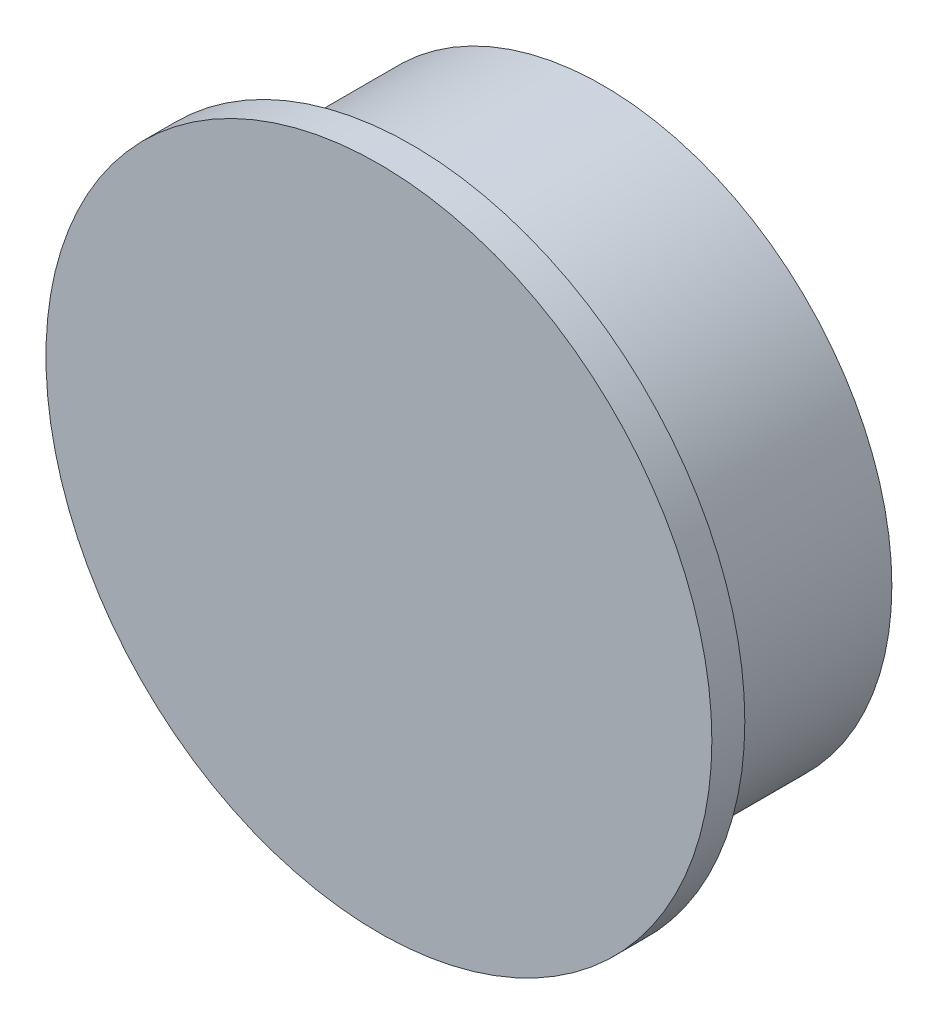
from build123d import *

# Parameters (mm, degrees)
SKETCH1_R           = 30.5
BOSS_EXTRUDE1_DEPTH = 20.18
SKETCH2_R           = 35.155
BOSS_EXTRUDE2_DEPTH = 3.48


with BuildPart() as part:
    # Sketch1 → Boss-Extrude1 (new body)
    with BuildSketch(Plane.XY):
        with Locations((34.697804605, 180.414111571)):
            Circle(SKETCH1_R)
    extrude(amount=BOSS_EXTRUDE1_DEPTH)

    # Sketch2 → Boss-Extrude2 (add)
    with BuildSketch(Plane.XY.offset(20.18)):
        with Locations((34.697804605, 180.414111571)):
            Circle(SKETCH2_R)
    extrude(amount=BOSS_EXTRUDE2_DEPTH)


solid = part.part
